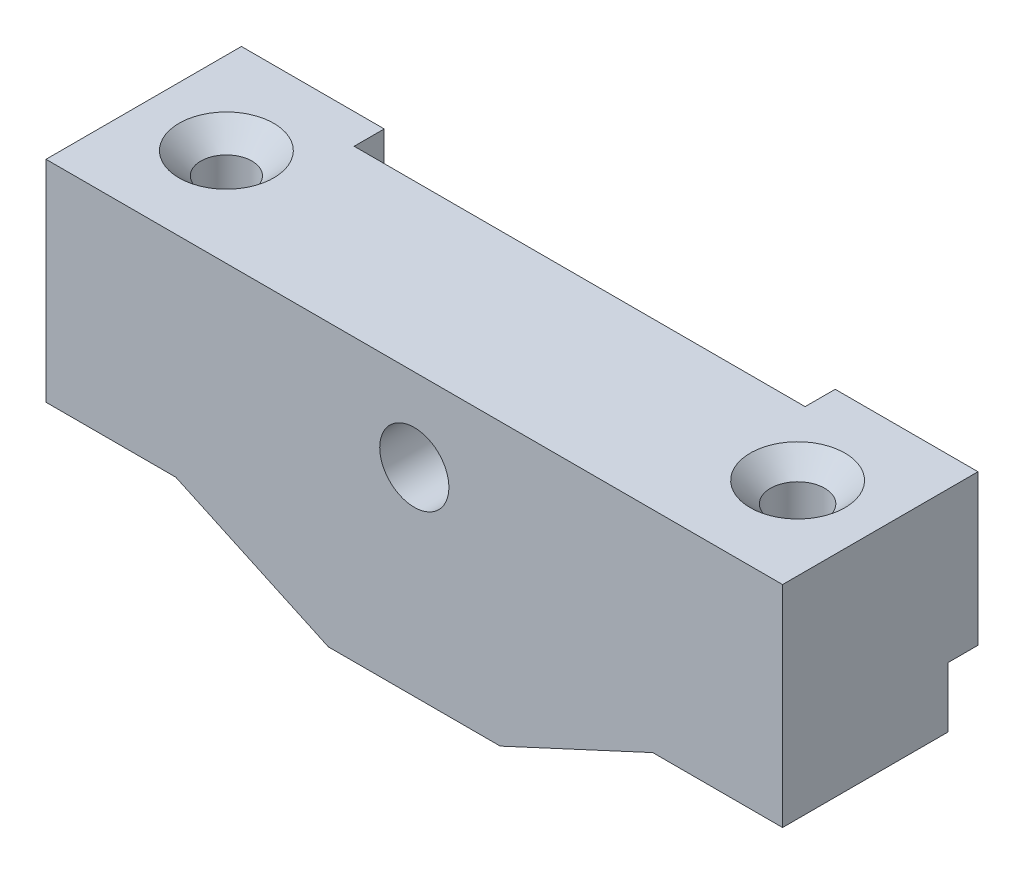
from build123d import *

# Parameters (mm, degrees)
BOSS_EXTRUDE1_DEPTH                             = 14
SKETCH3_R                                       = 4.125
CUT_EXTRUDE1_DEPTH                              = 8.8
SKETCH8_R                                       = 2.7
CUT_EXTRUDE3_DEPTH                              = 49.958231273
SKETCH11_W                                      = 49
SKETCH11_H                                      = 0.5
CUT_EXTRUDE6_DEPTH                              = 49.958231273
BOSS_EXTRUDE2_START                             = -4
SKETCH12_R                                      = 2.7
SKETCH12_R_2                                    = 1.5
SKETCH12_R_3                                    = 1.8
BOSS_EXTRUDE2_DEPTH                             = 4
CUT_EXTRUDE7_DEPTH                              = 2
BOSS_EXTRUDE3_START                             = 5
SKETCH18_R                                      = 2.7
SKETCH18_R_2                                    = 2.4
BOSS_EXTRUDE3_DEPTH                             = 5
SKETCH17_R                                      = 2.3
SKETCH17_W                                      = 11.431818182
SKETCH17_H                                      = 0.1
CUT_EXTRUDE8_DEPTH                              = 22
BOSS_EXTRUDE4_DEPTH                             = 4
BOSS_EXTRUDE4_DEPTH_BACK                        = 10
SKETCH20_W                                      = 9.5
SKETCH20_H                                      = 11
SKETCH20_R                                      = 2.7
SKETCH20_R_2                                    = 2.55
CUT_EXTRUDE9_START                              = -10
SKETCH21_R                                      = 2.55
SKETCH21_R_2                                    = 2.7
CUT_EXTRUDE9_DEPTH                              = 10
CSK_FOR_M3_FLAT_HEAD_MACHINE_SCREW1_D           = 3.4
CSK_FOR_M3_FLAT_HEAD_MACHINE_SCREW1_CSINK_D     = 6.3
CSK_FOR_M3_FLAT_HEAD_MACHINE_SCREW1_CSINK_ANGLE = 90


with BuildPart() as part:
    # Sketch2 → Boss-Extrude1 (new body)
    with BuildSketch(Plane.XY):
        Polygon((12.982187117, 18.175494031), (23.982187117, 18.175494031), (42.982187117, 26.975494031), (42.982187117, 36.975494031), (-6.017812883, 36.975494031), (-6.017812883, 26.975494031), align=None)
    extrude(amount=BOSS_EXTRUDE1_DEPTH)

    # Sketch3 → Cut-Extrude1 (cut)
    with BuildSketch(Plane.XZ.offset(-18.175494031)):
        with Locations(Location((18.482187117, 7, 0), (0, 0, 270))):
            Circle(SKETCH3_R)
    extrude(amount=-CUT_EXTRUDE1_DEPTH, mode=Mode.SUBTRACT)

    # Sketch8 → Cut-Extrude3 (cut, through all)
    with BuildSketch(Plane.XZ.offset(-18.175494031)):
        with Locations(Location((37.482187117, 7, 0), (0, 0, 270))):
            Circle(SKETCH8_R)
        with Locations(Location((-0.517812883, 7, 0), (0, 0, 270))):
            Circle(SKETCH8_R)
    extrude(amount=-CUT_EXTRUDE3_DEPTH, mode=Mode.SUBTRACT)

    # Sketch11 → Cut-Extrude6 (cut, through all)
    with BuildSketch(Plane.XZ.offset(-18.175494031)):
        with Locations((18.482187117, 13.75)):
            Rectangle(SKETCH11_W, SKETCH11_H)
        with Locations((18.482187117, 0.25)):
            Rectangle(SKETCH11_W, SKETCH11_H)
    extrude(amount=-CUT_EXTRUDE6_DEPTH, mode=Mode.SUBTRACT)

    # Sketch12 → Boss-Extrude2 (add)
    # profile 1 of 2: a face of its own
    with BuildSketch(Plane(origin=(0, 36.975494031, 0), x_dir=(1, 0, 0), z_dir=(0, 1, 0)).offset(BOSS_EXTRUDE2_START)):
        with Locations((-0.517812883, -7)):
            Circle(SKETCH12_R)
        with Locations(Location((-0.517812883, -7, 0), (0, 0, 270))):
            Circle(SKETCH12_R_2, mode=Mode.SUBTRACT)
    # profile 2 of 2: a face of its own
    with BuildSketch(Plane(origin=(0, 36.975494031, 0), x_dir=(1, 0, 0), z_dir=(0, 1, 0)).offset(BOSS_EXTRUDE2_START)):
        with Locations(Location((37.482187117, -7, 0), (0, 0, 180))):
            Circle(SKETCH12_R)
        with Locations(Location((37.482187117, -7, 0), (0, 0, 270))):
            Circle(SKETCH12_R_3, mode=Mode.SUBTRACT)
    extrude(amount=BOSS_EXTRUDE2_DEPTH)

    # Sketch15 → Cut-Extrude7 (cut)
    with BuildSketch(Plane(origin=(0, 0, 0.5), x_dir=(-1, 0, 0), z_dir=(0, 0, -1))):
        Polygon((-33.482187117, 22.575494031), (-33.482187117, 36.975494031), (-3.482187117, 36.975494031), (-3.482187117, 22.575494031), (-12.982187117, 18.175494031), (-23.982187117, 18.175494031), align=None)
    extrude(amount=-CUT_EXTRUDE7_DEPTH, mode=Mode.SUBTRACT)

    # Sketch18 → Boss-Extrude3 (add)
    # profile 1 of 2: a face of its own
    with BuildSketch(Plane.XZ.offset(-32.975494031).offset(BOSS_EXTRUDE3_START)):
        with Locations(Location((37.482187117, 7, 0), (0, 0, 270))):
            Circle(SKETCH18_R)
        with Locations(Location((37.482187117, 7, 0), (0, 0, 270))):
            Circle(SKETCH18_R_2, mode=Mode.SUBTRACT)
    # profile 2 of 2: a face of its own
    with BuildSketch(Plane.XZ.offset(-32.975494031).offset(BOSS_EXTRUDE3_START)):
        with Locations(Location((-0.517812883, 7, 0), (0, 0, 270))):
            Circle(SKETCH18_R)
        with Locations(Location((-0.517812883, 7, 0), (0, 0, 270))):
            Circle(SKETCH18_R_2, mode=Mode.SUBTRACT)
    extrude(amount=-BOSS_EXTRUDE3_DEPTH)

    # Sketch17 → Cut-Extrude8 (cut)
    with BuildSketch(Plane(origin=(0, 0, 2.5), x_dir=(-1, 0, 0), z_dir=(0, 0, -1))):
        with Locations((-18.482187117, 31.475494031)):
            Circle(SKETCH17_R)
        with Locations((-18.482187117, 18.225494031)):
            Rectangle(SKETCH17_W, SKETCH17_H)
    extrude(amount=-CUT_EXTRUDE8_DEPTH, mode=Mode.SUBTRACT)

    # Sketch20 → Boss-Extrude4 (add, two sides: drawn at the far end of the back side and taken through both)
    # profile 1 of 2: a face of its own
    with BuildSketch(Plane(origin=(0, 26.975494031, 0), x_dir=(-1, 0, 0), z_dir=(0, -1, 0)).offset(-BOSS_EXTRUDE4_DEPTH_BACK)):
        with Locations((-38.232187117, -8)):
            Rectangle(SKETCH20_W, SKETCH20_H)
        with Locations(Location((-37.482187117, -7, 0), (0, 0, 90))):
            Circle(SKETCH20_R, mode=Mode.SUBTRACT)
    # profile 2 of 2: a face of its own
    with BuildSketch(Plane(origin=(0, 26.975494031, 0), x_dir=(-1, 0, 0), z_dir=(0, -1, 0)).offset(-BOSS_EXTRUDE4_DEPTH_BACK)):
        with Locations((1.267812883, -8)):
            Rectangle(SKETCH20_W, SKETCH20_H)
        with Locations(Location((0.517812883, -7, 0), (0, 0, 90))):
            Circle(SKETCH20_R_2, mode=Mode.SUBTRACT)
    extrude(amount=BOSS_EXTRUDE4_DEPTH + BOSS_EXTRUDE4_DEPTH_BACK)

    # Sketch21 → Cut-Extrude9 (cut)
    with BuildSketch(Plane.XZ.offset(-22.975494031).offset(CUT_EXTRUDE9_START)):
        with Locations(Location((-0.517812883, 7, 0), (0, 0, 270))):
            Circle(SKETCH21_R)
        with Locations(Location((37.482187117, 7, 0), (0, 0, 270))):
            Circle(SKETCH21_R_2)
    extrude(amount=CUT_EXTRUDE9_DEPTH, mode=Mode.SUBTRACT)

    # CSK for M3 Flat Head Machine Screw1 (through all)
    with Locations(Plane(origin=(0, 36.975494031, 0), x_dir=(1, 0, 0), z_dir=(0, 1, 0))):
        with Locations((-0.517812883, -7), (37.482187117, -7)):
            CounterSinkHole(CSK_FOR_M3_FLAT_HEAD_MACHINE_SCREW1_D / 2, CSK_FOR_M3_FLAT_HEAD_MACHINE_SCREW1_CSINK_D / 2, counter_sink_angle=CSK_FOR_M3_FLAT_HEAD_MACHINE_SCREW1_CSINK_ANGLE)


solid = part.part
